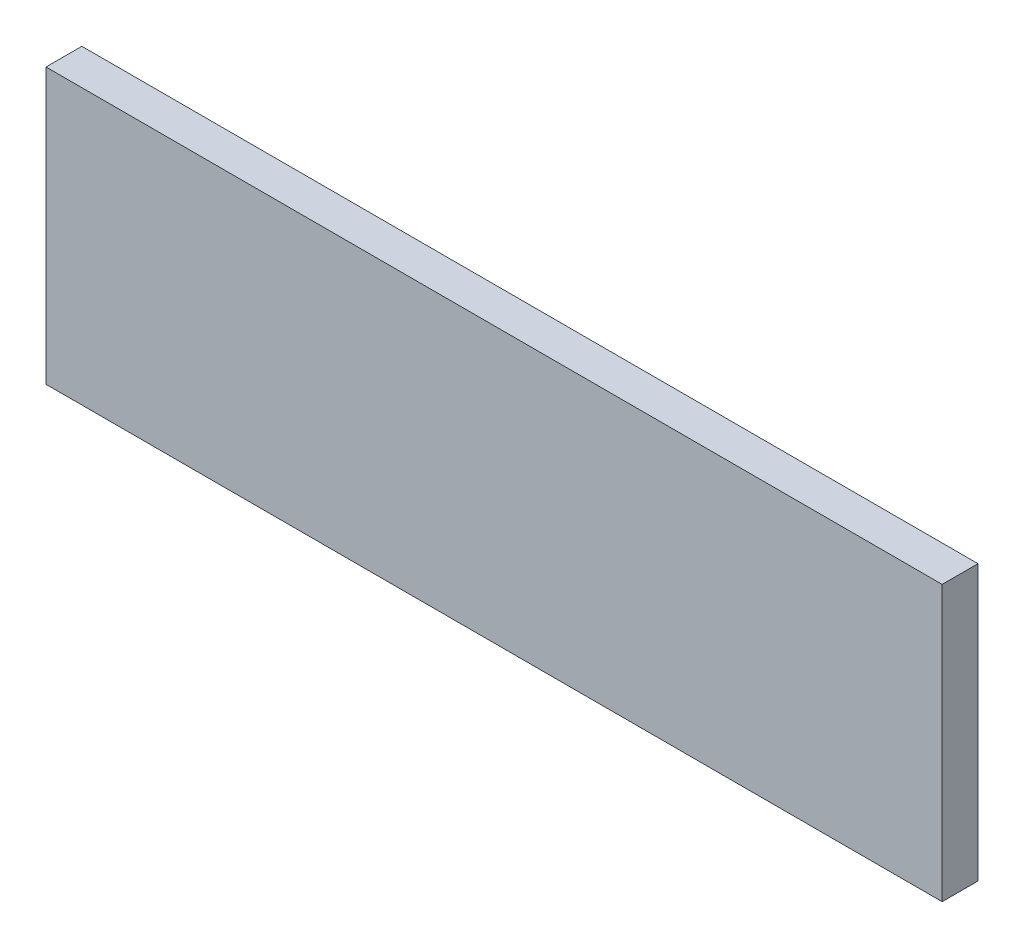
from build123d import *

# Parameters (mm, degrees)
SKETCH1_W           = 150
SKETCH1_H           = 46
BOSS_EXTRUDE1_DEPTH = 6


with BuildPart() as part:
    # Sketch1 → Boss-Extrude1 (new body)
    with BuildSketch(Plane.XY):
        Rectangle(SKETCH1_W, SKETCH1_H)
    extrude(amount=BOSS_EXTRUDE1_DEPTH)


solid = part.part
